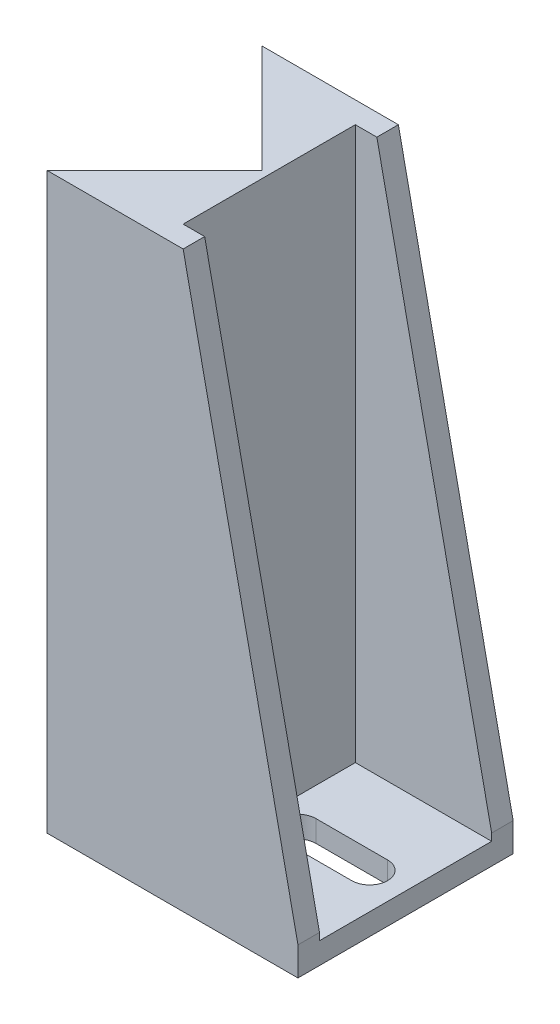
from build123d import *

# Parameters (mm, degrees)
BOSS_EXTRUDE1_DEPTH = 38.1
SHELL1_T            = -3.81
CUT_EXTRUDE1_DEPTH  = 3.81
BOSS_EXTRUDE2_DEPTH = 101.6
SKETCH5_W           = 24.13
SKETCH5_H           = 30.48
CUT_EXTRUDE2_DEPTH  = 97.79
BOSS_EXTRUDE3_DEPTH = 25.4


with BuildPart() as part:
    # Sketch1 → Boss-Extrude1 (new body)
    with BuildSketch(Plane.XY):
        Polygon((0, 0), (25.4, 0), (25.4, 5.08), (5.08, 101.6), (0, 101.6), align=None)
    extrude(amount=BOSS_EXTRUDE1_DEPTH)

    # Shell1
    shell1_openings = [part.faces().sort_by_distance(p)[0] for p in [
        (15.24, 53.34, 19.05),
    ]]
    offset(amount=SHELL1_T, openings=shell1_openings, kind=Kind.INTERSECTION)

    # Sketch2 → Cut-Extrude1 (cut)
    with BuildSketch(Plane.XZ):
        with BuildLine():
            Line((6.35, 22.225), (19.05, 22.225))
            ThreePointArc((19.05, 22.225), (22.225, 19.05), (19.05, 15.875))
            Line((19.05, 15.875), (6.35, 15.875))
            ThreePointArc((6.35, 15.875), (3.175, 19.05), (6.35, 22.225))
        make_face()
    extrude(amount=-CUT_EXTRUDE1_DEPTH, mode=Mode.SUBTRACT)

    # Sketch3 → Boss-Extrude2 (add)
    with BuildSketch(Plane(origin=(0, 101.6, 0), x_dir=(1, 0, 0), z_dir=(0, 1, 0))):
        Polygon((-19.05, 0), (0, -19.05), (0, 0), align=None)
        Polygon((0, -38.1), (0, -19.05), (-19.05, -38.1), align=None)
    extrude(amount=-BOSS_EXTRUDE2_DEPTH)

    # Sketch5 → Cut-Extrude2 (cut)
    with BuildSketch(Plane(origin=(0, 101.6, 0), x_dir=(1, 0, 0), z_dir=(0, 1, 0))):
        with Locations((13.335, -19.05)):
            Rectangle(SKETCH5_W, SKETCH5_H)
    extrude(amount=-CUT_EXTRUDE2_DEPTH, mode=Mode.SUBTRACT)

    # Sketch6 → Boss-Extrude3 (add)
    with BuildSketch(Plane.XZ):
        Polygon((-19.05, 0), (0, 19.05), (-19.05, 38.1), align=None)
    extrude(amount=-BOSS_EXTRUDE3_DEPTH)


solid = part.part
